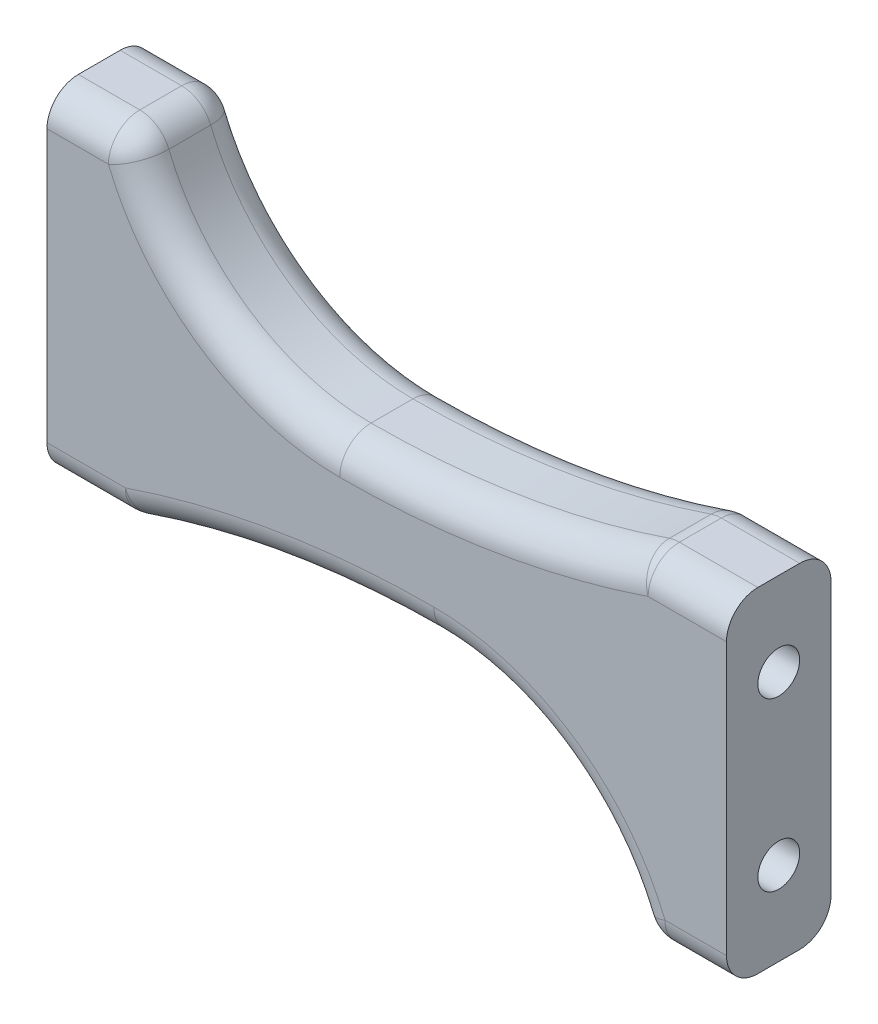
from build123d import *

# Parameters (mm, degrees)
BOSS_EXTRUDE1_DEPTH = 5
SKETCH2_R           = 2
CUT_EXTRUDE1_DEPTH  = 7
SKETCH3_R           = 2
CUT_EXTRUDE2_DEPTH  = 7
FILLET1_R           = 3


with BuildPart() as part:
    # Sketch1 → Boss-Extrude1 (new, symmetric)
    with BuildSketch(Plane.XY):
        with BuildLine():
            Line((0, 32), (0, 0))
            Line((0, 0), (8, 0))
            ThreePointArc((8, 0), (22.296085696, 3.651940128), (37, 4.880613018))
            ThreePointArc((37, 4.880613018), (49.464275388, 0.752368163), (57, -10))
            Line((57, -10), (65, -10))
            Line((65, -10), (65, 22))
            Line((65, 22), (57, 22))
            ThreePointArc((57, 22), (42.703914304, 18.348059872), (28, 17.119386982))
            ThreePointArc((28, 17.119386982), (15.535724612, 21.247631837), (8, 32))
            Line((8, 32), (0, 32))
        make_face()
    extrude(amount=BOSS_EXTRUDE1_DEPTH, both=True)

    # Sketch2 → Cut-Extrude1 (cut)
    with BuildSketch(Plane(origin=(65, 0, 0), x_dir=(0, 0, -1), z_dir=(1, 0, 0))):
        with Locations(Location((0, -2, 0), (0, 0, 90))):
            Circle(SKETCH2_R)
        with Locations(Location((0, 14, 0), (0, 0, 90))):
            Circle(SKETCH2_R)
    extrude(amount=-CUT_EXTRUDE1_DEPTH, mode=Mode.SUBTRACT)

    # Sketch3 → Cut-Extrude2 (cut)
    with BuildSketch(Plane.ZY):
        with Locations((0, 8)):
            Circle(SKETCH3_R)
        with Locations((0, 24)):
            Circle(SKETCH3_R)
    extrude(amount=-CUT_EXTRUDE2_DEPTH, mode=Mode.SUBTRACT)

    # Fillet1
    fillet1_edges = [part.edges().sort_by_distance(p)[0] for p in [
        (15.535724612, 21.247631837, -5),
        (42.703914304, 18.348059872, -5),
        (61, 22, -5),
        (61, -10, -5),
        (49.464275388, 0.752368163, -5),
        (22.296085696, 3.651940128, -5),
        (4, 0, 5),
        (4, 0, -5),
        (4, 32, -5),
        (22.296085696, 3.651940128, 5),
        (8, 32, 0),
        (57, 22, 0),
        (57, -10, 0),
        (8, 0, 0),
        (49.464275388, 0.752368163, 5),
        (61, -10, 5),
        (61, 22, 5),
        (42.703914304, 18.348059872, 5),
        (15.535724612, 21.247631837, 5),
        (4, 32, 5),
    ]]
    fillet(fillet1_edges, radius=FILLET1_R)


solid = part.part
